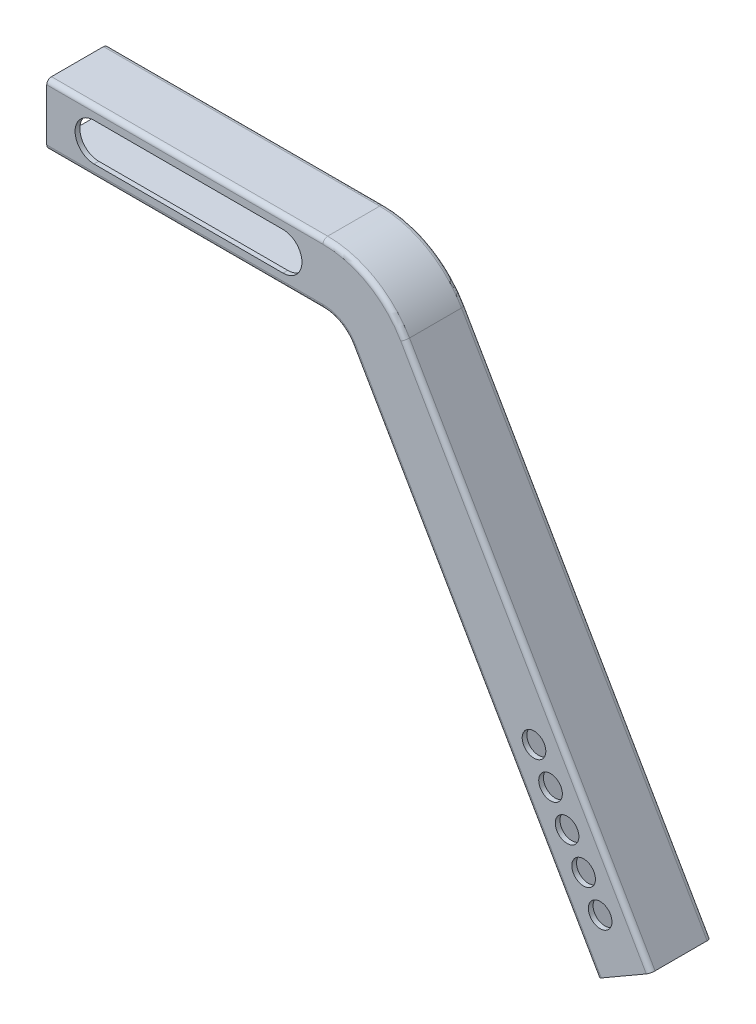
from build123d import *

# Parameters (mm, degrees)
BOSS_EXTRUDE1_DEPTH = 33.02
SHELL1_T            = -2.54
CUT_EXTRUDE1_REACH  = 409.111
SKETCH2_W           = 27.94
SKETCH2_H           = 27.94
CUT_EXTRUDE2_DEPTH  = 2.54
CUT_EXTRUDE3_START  = -2.54
CUT_EXTRUDE3_DEPTH  = 2.54
CUT_EXTRUDE4_REACH  = 303.28
SKETCH5_R           = 6.35
FILLET1_R           = 2.54


with BuildPart() as part:
    # Sketch1 → Boss-Extrude1 (new body)
    with BuildSketch(Plane.XY):
        with BuildLine():
            Line((-172.046968374, 25.4), (-23.576362049, 25.4))
            ThreePointArc((-23.576362049, 25.4), (1.823637951, 18.594090512), (20.417728463, 0))
            Line((20.417728463, 0), (152.4, -228.6))
            Line((152.4, -228.6), (123.803841167, -245.11))
            Line((123.803841167, -245.11), (-8.17843037, -16.51))
            ThreePointArc((-8.17843037, -16.51), (-14.686362049, -10.002068321), (-23.576362049, -7.62))
            Line((-23.576362049, -7.62), (-172.046968374, -7.62))
            Line((-172.046968374, -7.62), (-172.046968374, 25.4))
        make_face()
    extrude(amount=BOSS_EXTRUDE1_DEPTH)

    # Shell1
    shell1_openings = [part.faces().sort_by_distance(p)[0] for p in [
        (-172.046968374, 8.89, 16.51),
    ]]
    offset(amount=SHELL1_T, openings=shell1_openings, kind=Kind.INTERSECTION)

    # Sketch2 → Cut-Extrude1 (cut, up to next)
    with BuildSketch(Plane(origin=(137.086703653, -237.441135768, 0), x_dir=(0.8660254037844406, 0.4999999999999967, 0), z_dir=(0.4999999999999967, -0.8660254037844406, 0)), mode=Mode.PRIVATE) as cut_extrude1_sk1:
        with Locations((1.172271537, 16.51)):
            Rectangle(SKETCH2_W, SKETCH2_H)
    cut_extrude1_tool1 = extrude(cut_extrude1_sk1.sketch, amount=-CUT_EXTRUDE1_REACH, mode=Mode.PRIVATE) & part.part
    add(cut_extrude1_tool1.solids().sort_by_distance((138.101921, -236.855, 16.51))[0], mode=Mode.SUBTRACT)

    # Sketch3 → Cut-Extrude2 (cut)
    with BuildSketch(Plane.XY.offset(33.02)):
        with BuildLine():
            Line((-146.646968374, 19.05), (-45.046968374, 19.05))
            ThreePointArc((-45.046968374, 19.05), (-34.886968374, 8.89), (-45.046968374, -1.27))
            Line((-45.046968374, -1.27), (-50.126968374, -1.27))
            Line((-50.126968374, -1.27), (-146.646968374, -1.27))
            ThreePointArc((-146.646968374, -1.27), (-156.806968374, 8.89), (-146.646968374, 19.05))
        make_face()
    extrude(amount=-CUT_EXTRUDE2_DEPTH, mode=Mode.SUBTRACT)

    # Sketch4 → Cut-Extrude3 (cut)
    with BuildSketch(Plane(origin=(0, 0, 0), x_dir=(-1, 0, 0), z_dir=(0, 0, -1)).offset(CUT_EXTRUDE3_START)):
        with BuildLine():
            Line((141.566968374, -1.27), (146.646968374, -1.27))
            ThreePointArc((146.646968374, -1.27), (156.806968374, 8.89), (146.646968374, 19.05))
            Line((146.646968374, 19.05), (45.046968374, 19.05))
            ThreePointArc((45.046968374, 19.05), (34.886968374, 8.89), (45.046968374, -1.27))
            Line((45.046968374, -1.27), (141.566968374, -1.27))
        make_face()
    extrude(amount=CUT_EXTRUDE3_DEPTH, mode=Mode.SUBTRACT)

    # Sketch5 → Cut-Extrude4 (cut, up to next)
    with BuildSketch(Plane.XY.offset(33.02), mode=Mode.PRIVATE) as cut_extrude4_sk1:
        with Locations((125.401920584, -214.857954744)):
            Circle(SKETCH5_R)
    cut_extrude4_tool1 = extrude(cut_extrude4_sk1.sketch, amount=-CUT_EXTRUDE4_REACH, mode=Mode.PRIVATE) & part.part
    # Sketch5 → Cut-Extrude4 (cut, up to next)
    with BuildSketch(Plane.XY.offset(33.02), mode=Mode.PRIVATE) as cut_extrude4_sk2:
        with Locations((116.511920584, -199.460023065)):
            Circle(SKETCH5_R)
    cut_extrude4_tool2 = extrude(cut_extrude4_sk2.sketch, amount=-CUT_EXTRUDE4_REACH, mode=Mode.PRIVATE) & part.part
    # Sketch5 → Cut-Extrude4 (cut, up to next)
    with BuildSketch(Plane.XY.offset(33.02), mode=Mode.PRIVATE) as cut_extrude4_sk3:
        with Locations((107.621920584, -184.062091385)):
            Circle(SKETCH5_R)
    cut_extrude4_tool3 = extrude(cut_extrude4_sk3.sketch, amount=-CUT_EXTRUDE4_REACH, mode=Mode.PRIVATE) & part.part
    # Sketch5 → Cut-Extrude4 (cut, up to next)
    with BuildSketch(Plane.XY.offset(33.02), mode=Mode.PRIVATE) as cut_extrude4_sk4:
        with Locations((98.731920584, -168.664159706)):
            Circle(SKETCH5_R)
    cut_extrude4_tool4 = extrude(cut_extrude4_sk4.sketch, amount=-CUT_EXTRUDE4_REACH, mode=Mode.PRIVATE) & part.part
    # Sketch5 → Cut-Extrude4 (cut, up to next)
    with BuildSketch(Plane.XY.offset(33.02), mode=Mode.PRIVATE) as cut_extrude4_sk5:
        with Locations((89.841920584, -153.266228027)):
            Circle(SKETCH5_R)
    cut_extrude4_tool5 = extrude(cut_extrude4_sk5.sketch, amount=-CUT_EXTRUDE4_REACH, mode=Mode.PRIVATE) & part.part
    add(cut_extrude4_tool1.solids().sort_by_distance((125.401921, -214.857955, 33.02))[0], mode=Mode.SUBTRACT)
    add(cut_extrude4_tool2.solids().sort_by_distance((116.511921, -199.460023, 33.02))[0], mode=Mode.SUBTRACT)
    add(cut_extrude4_tool3.solids().sort_by_distance((107.621921, -184.062091, 33.02))[0], mode=Mode.SUBTRACT)
    add(cut_extrude4_tool4.solids().sort_by_distance((98.731921, -168.66416, 33.02))[0], mode=Mode.SUBTRACT)
    add(cut_extrude4_tool5.solids().sort_by_distance((89.841921, -153.266228, 33.02))[0], mode=Mode.SUBTRACT)

    # Fillet1
    fillet1_edges = [part.edges().sort_by_distance(p)[0] for p in [
        (57.812705399, -130.81, 0),
        (-14.686362049, -10.002068321, 0),
        (-97.811665212, -7.62, 0),
        (-14.686362049, -10.002068321, 33.02),
        (57.812705399, -130.81, 33.02),
        (86.408864232, -114.3, 33.02),
        (1.823637951, 18.594090512, 33.02),
        (-97.811665212, 25.4, 33.02),
        (-97.811665212, 25.4, 0),
        (-97.811665212, -7.62, 33.02),
        (1.823637951, 18.594090512, 0),
        (86.408864232, -114.3, 0),
    ]]
    fillet(fillet1_edges, radius=FILLET1_R)


solid = part.part
